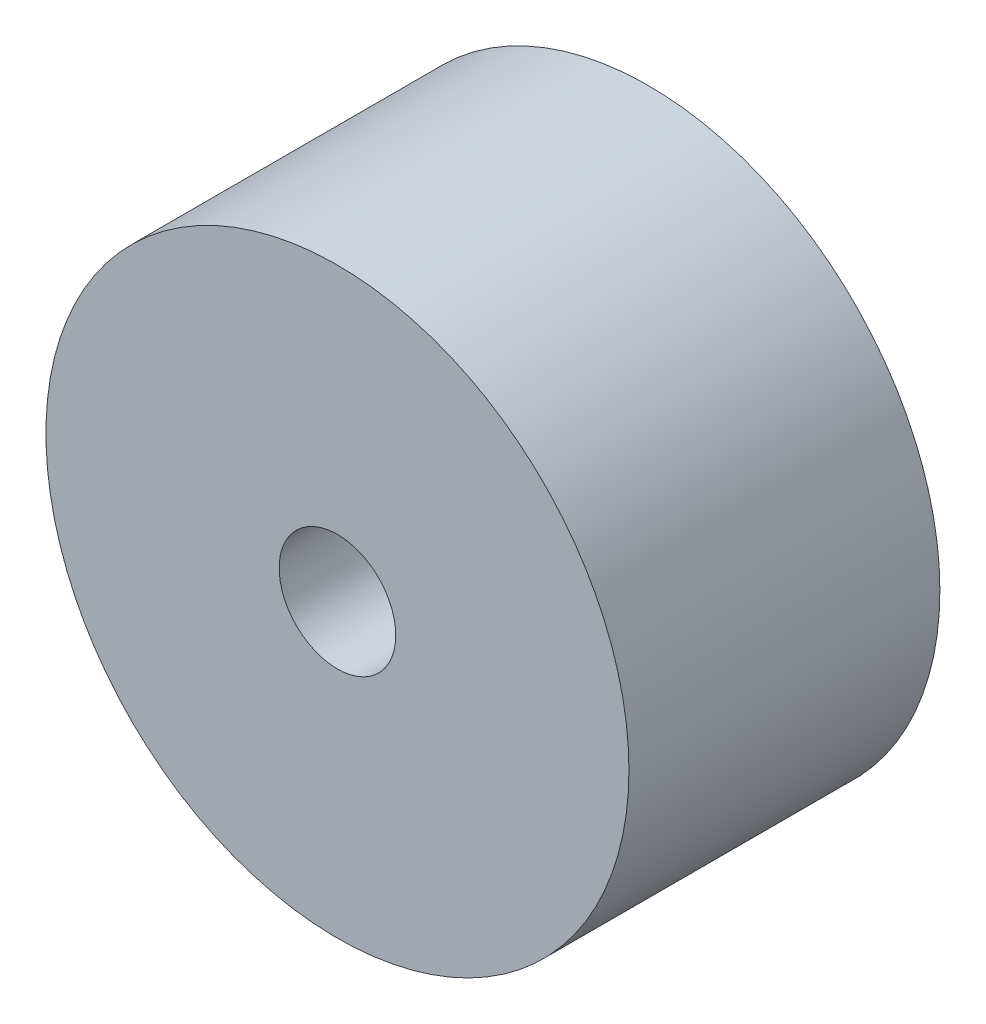
from build123d import *

# Parameters (mm, degrees)
SKETCH1_R           = 7.5
SKETCH1_R_2         = 1.5
BOSS_EXTRUDE2_DEPTH = 8


with BuildPart() as part:
    # Sketch1 → Boss-Extrude2 (new body)
    with BuildSketch(Plane.XY):
        with Locations((-38.082539743, 17.932069685)):
            Circle(SKETCH1_R)
        with Locations((-38.082539743, 17.932069685)):
            Circle(SKETCH1_R_2, mode=Mode.SUBTRACT)
    extrude(amount=BOSS_EXTRUDE2_DEPTH)


solid = part.part
